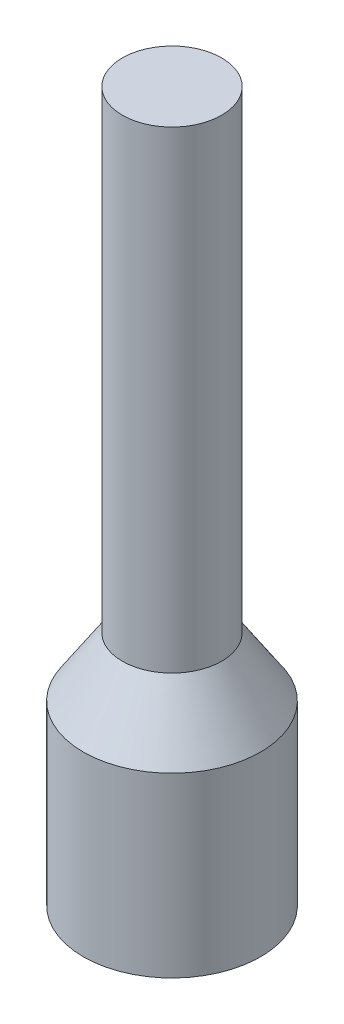
from build123d import *


with BuildPart() as part:
    # Sketch1 → Revolve1 (revolve)
    with BuildSketch(Plane.XY, mode=Mode.PRIVATE) as revolve1_sk:
        Polygon((0, 0), (37.5, 0), (37.5, 75), (21, 100), (21, 300), (0, 300), align=None)
    revolve(revolve1_sk.sketch.rotate(Axis((0, 334.417519896, 0), (0, -1, 0)), 90), axis=Axis((0, 334.417519896, 0), (0, -1, 0)))


solid = part.part
